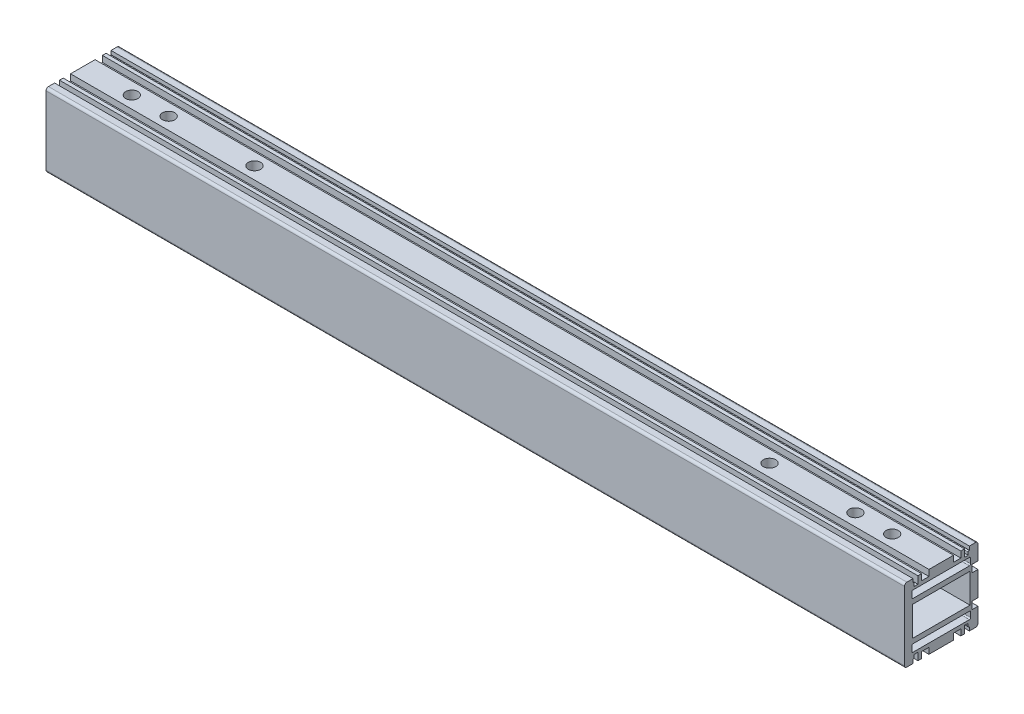
from build123d import *

# Parameters (mm, degrees)
SKETCH_1_W             = 23.5
SKETCH_1_H             = 12
EXTRUDE_1_DEPTH        = 175
HOLE_WIZARD_M6_1_D     = 5
HOLE_WIZARD_M6_1_DEPTH = 15
HOLE_WIZARD_M6_1_TIP   = 1.502151548
HOLE_WIZARD_M6_2_D     = 5
HOLE_WIZARD_M6_2_DEPTH = 15
HOLE_WIZARD_M6_2_TIP   = 1.502151548
HOLE_WIZARD_M4_1_D     = 3.3
HOLE_WIZARD_M4_1_DEPTH = 10.1
HOLE_WIZARD_M4_1_TIP   = 0.991420021
HOLE_WIZARD_M6_3_D     = 5
HOLE_WIZARD_M6_3_DEPTH = 15
HOLE_WIZARD_M6_3_TIP   = 1.502151548


with BuildPart() as part:
    # 草图1 → 凸台-拉伸1 (new, symmetric)
    with BuildSketch(Plane(origin=(0, 0, 0), x_dir=(0, 0, -1), z_dir=(1, 0, 0))):
        with BuildLine():
            Line((-14, 15), (-11.5, 15))
            Line((-11.5, 15), (-11.5, 13.5))
            Line((-11.5, 13.5), (-11.4, 13.5))
            ThreePointArc((-11.4, 13.5), (-11.117157288, 13.382842712), (-11, 13.1))
            Line((-11, 13.1), (-11, 12))
            Line((-11, 12), (-9.5, 12))
            Line((-9.5, 12), (-9.5, 15))
            Line((-9.5, 15), (-8, 15))
            Line((-8, 15), (-8, 12.5))
            Line((-8, 12.5), (-5, 12.5))
            Line((-5, 12.5), (-5, 15))
            Line((-5, 15), (5, 15))
            Line((5, 15), (5, 12.5))
            Line((5, 12.5), (8, 12.5))
            Line((8, 12.5), (8, 15))
            Line((8, 15), (9.5, 15))
            Line((9.5, 15), (9.5, 12))
            Line((9.5, 12), (11, 12))
            Line((11, 12), (11, 13.1))
            ThreePointArc((11, 13.1), (11.117157288, 13.382842712), (11.4, 13.5))
            Line((11.4, 13.5), (11.5, 13.5))
            Line((11.5, 13.5), (11.5, 15))
            Line((11.5, 15), (14, 15))
            ThreePointArc((14, 15), (14.707106781, 14.707106781), (15, 14))
            Line((15, 14), (15, 8))
            Line((15, 8), (12.5, 8))
            Line((12.5, 8), (12.5, 5))
            Line((12.5, 5), (15, 5))
            Line((15, 5), (15, -5))
            Line((15, -5), (12.5, -5))
            Line((12.5, -5), (12.5, -8))
            Line((12.5, -8), (15, -8))
            Line((15, -8), (15, -14))
            ThreePointArc((15, -14), (14.707106781, -14.707106781), (14, -15))
            Line((14, -15), (11.5, -15))
            Line((11.5, -15), (11.5, -13.5))
            Line((11.5, -13.5), (11.4, -13.5))
            ThreePointArc((11.4, -13.5), (11.117157288, -13.382842712), (11, -13.1))
            Line((11, -13.1), (11, -12))
            Line((11, -12), (9.5, -12))
            Line((9.5, -12), (9.5, -15))
            Line((9.5, -15), (8, -15))
            Line((8, -15), (8, -12.5))
            Line((8, -12.5), (5, -12.5))
            Line((5, -12.5), (5, -15))
            Line((5, -15), (-5, -15))
            Line((-5, -15), (-5, -12.5))
            Line((-5, -12.5), (-8, -12.5))
            Line((-8, -12.5), (-8, -15))
            Line((-8, -15), (-9.5, -15))
            Line((-9.5, -15), (-9.5, -12))
            Line((-9.5, -12), (-11, -12))
            Line((-11, -12), (-11, -13.1))
            ThreePointArc((-11, -13.1), (-11.117157288, -13.382842712), (-11.4, -13.5))
            Line((-11.4, -13.5), (-11.5, -13.5))
            Line((-11.5, -13.5), (-11.5, -15))
            Line((-11.5, -15), (-14, -15))
            ThreePointArc((-14, -15), (-14.707106781, -14.707106781), (-15, -14))
            Line((-15, -14), (-15, 14))
            ThreePointArc((-15, 14), (-14.707106781, 14.707106781), (-14, 15))
        make_face()
        with BuildLine():
            Line((12, -10.5), (12, -8.5))
            ThreePointArc((12, -8.5), (11.853553391, -8.146446609), (11.5, -8))
            Line((11.5, -8), (-11.5, -8))
            ThreePointArc((-11.5, -8), (-11.853553391, -8.146446609), (-12, -8.5))
            Line((-12, -8.5), (-12, -10.5))
            ThreePointArc((-12, -10.5), (-11.853553391, -10.853553391), (-11.5, -11))
            Line((-11.5, -11), (11.5, -11))
            ThreePointArc((11.5, -11), (11.853553391, -10.853553391), (12, -10.5))
        make_face(mode=Mode.SUBTRACT)
        with BuildLine():
            Line((-11.5, 11), (11.5, 11))
            ThreePointArc((11.5, 11), (11.853553391, 10.853553391), (12, 10.5))
            Line((12, 10.5), (12, 8.5))
            ThreePointArc((12, 8.5), (11.853553391, 8.146446609), (11.5, 8))
            Line((11.5, 8), (-11.5, 8))
            ThreePointArc((-11.5, 8), (-11.853553391, 8.146446609), (-12, 8.5))
            Line((-12, 8.5), (-12, 10.5))
            ThreePointArc((-12, 10.5), (-11.853553391, 10.853553391), (-11.5, 11))
        make_face(mode=Mode.SUBTRACT)
        Rectangle(SKETCH_1_W, SKETCH_1_H, mode=Mode.SUBTRACT)
    extrude(amount=EXTRUDE_1_DEPTH, both=True)

    # M6 螺纹孔1
    with Locations(Plane(origin=(0, 15, 0), x_dir=(-1, 0, 0), z_dir=(0, 1, 0))):
        with Locations((-155, 0), (-140, 0), (140, 0), (155, 0)):
            Hole(HOLE_WIZARD_M6_1_D / 2, depth=HOLE_WIZARD_M6_1_DEPTH)
            with Locations((0, 0, -(HOLE_WIZARD_M6_1_DEPTH + HOLE_WIZARD_M6_1_TIP / 2))):  # 118° drill point
                Cone(0, HOLE_WIZARD_M6_1_D / 2, HOLE_WIZARD_M6_1_TIP, mode=Mode.SUBTRACT)

    # M6 螺纹孔2
    with Locations(Plane.XZ.offset(15)):
        with Locations((155, 0), (140, 0), (-140, 0), (-155, 0)):
            Hole(HOLE_WIZARD_M6_2_D / 2, depth=HOLE_WIZARD_M6_2_DEPTH)
            with Locations((0, 0, -(HOLE_WIZARD_M6_2_DEPTH + HOLE_WIZARD_M6_2_TIP / 2))):  # 118° drill point
                Cone(0, HOLE_WIZARD_M6_2_D / 2, HOLE_WIZARD_M6_2_TIP, mode=Mode.SUBTRACT)

    # M4 螺纹孔1
    with Locations(Plane(origin=(0, 0, -15), x_dir=(-1, 0, 0), z_dir=(0, 0, -1))):
        with Locations((145, 0), (45, 0), (-55, 0)):
            Hole(HOLE_WIZARD_M4_1_D / 2, depth=HOLE_WIZARD_M4_1_DEPTH)
            with Locations((0, 0, -(HOLE_WIZARD_M4_1_DEPTH + HOLE_WIZARD_M4_1_TIP / 2))):  # 118° drill point
                Cone(0, HOLE_WIZARD_M4_1_D / 2, HOLE_WIZARD_M4_1_TIP, mode=Mode.SUBTRACT)

    # M6 螺纹孔3
    with Locations(Plane(origin=(0, 15, 0), x_dir=(-1, 0, 0), z_dir=(0, 1, 0))):
        with Locations((105, 0), (-105, 0)):
            Hole(HOLE_WIZARD_M6_3_D / 2, depth=HOLE_WIZARD_M6_3_DEPTH)
            with Locations((0, 0, -(HOLE_WIZARD_M6_3_DEPTH + HOLE_WIZARD_M6_3_TIP / 2))):  # 118° drill point
                Cone(0, HOLE_WIZARD_M6_3_D / 2, HOLE_WIZARD_M6_3_TIP, mode=Mode.SUBTRACT)


solid = part.part
